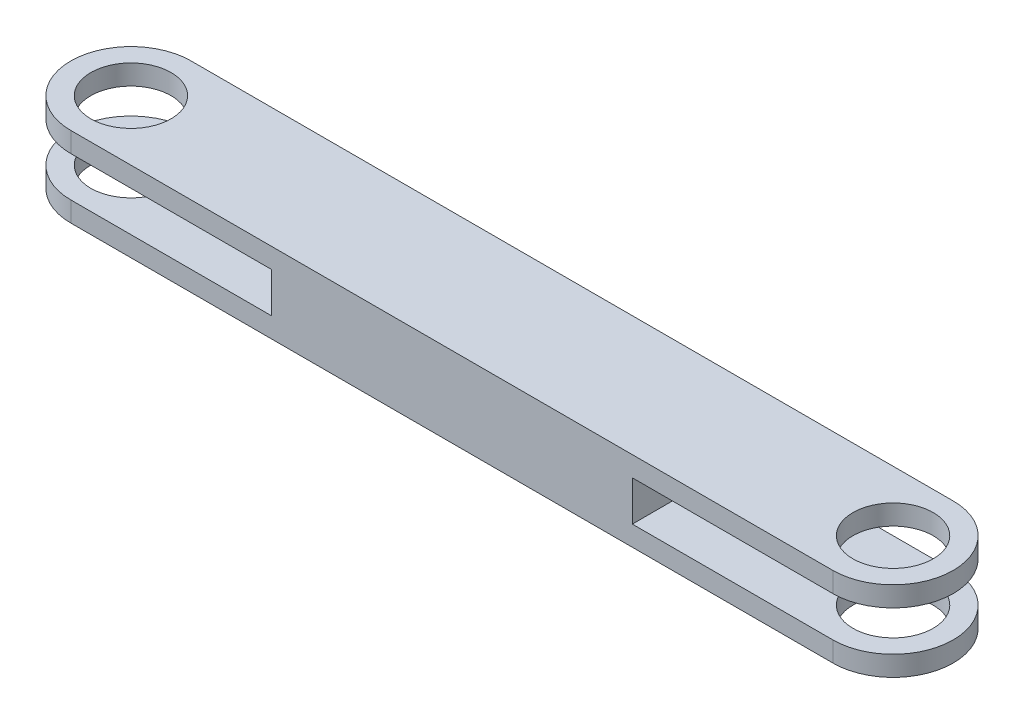
from build123d import *
from build123d.topology import SkipClean

# Parameters (mm, degrees)
EXTRUDE_1_DEPTH     = 10
CUT_EXTRUDE_1_DEPTH = 5


with BuildPart() as part:
    # 草圖1 → 填料-伸長1 (new, symmetric)
    with BuildSketch(Plane(origin=(0, 0, 0), x_dir=(1, 0, 0), z_dir=(0, 1, 0))):
        with BuildLine():
            Line((95.00000000000004, 14.999999999999998), (-94.99999999999996, 15))
            ThreePointArc((-94.99999999999996, 14.999999999999998), (-84.39339828220174, 10.606601717798211), (-79.99999999999996, 0))
            ThreePointArc((-79.99999999999996, -3.67e-15), (-84.39339828220174, -10.606601717798204), (-94.99999999999994, -14.999999999999998))
            Line((-94.99999999999994, -14.999999999999961), (95.00000000000006, -14.999999999999998))
            ThreePointArc((95.00000000000004, -14.999999999999998), (80.00000000000004, 1.84e-15), (95.00000000000004, 14.999999999999998))
        make_face()
        with BuildLine():
            ThreePointArc((-79.99999999999996, 0), (-84.39339828220174, 10.606601717798211), (-94.99999999999996, 14.999999999999998))
            Line((-94.99999999999996, 15), (-94.99999999999996, 10.000000000000009))
            ThreePointArc((-95, 10.000000000000009), (-87.9289321881345, 7.071067811865497), (-84.99999999999994, 0))
            ThreePointArc((-84.99999999999994, -2.45e-15), (-87.9289321881345, -7.071067811865502), (-95, -10.000000000000009))
            Line((-94.99999999999994, -10.000000000000007), (-94.99999999999994, -14.999999999999961))
            ThreePointArc((-94.99999999999994, -14.999999999999998), (-84.39339828220174, -10.606601717798204), (-79.99999999999996, -3.67e-15))
        make_face()
        with BuildLine():
            Line((-94.99999999999996, 10.000000000000009), (-94.99999999999996, 15))
            ThreePointArc((-94.99999999999996, 14.999999999999998), (-109.99999999999996, -4.82e-15), (-94.99999999999994, -14.999999999999998))
            Line((-94.99999999999994, -14.999999999999961), (-94.99999999999994, -10.000000000000007))
            ThreePointArc((-95, -10.000000000000009), (-104.99999999999997, 1.22e-15), (-95, 10.000000000000009))
        make_face()
        with BuildLine():
            ThreePointArc((-79.99999999999996, 0), (-84.39339828220174, 10.606601717798211), (-94.99999999999996, 14.999999999999998))
            Line((-94.99999999999996, 15), (-94.99999999999996, 10.000000000000009))
            ThreePointArc((-95, 10.000000000000009), (-87.9289321881345, 7.071067811865497), (-84.99999999999994, 0))
            ThreePointArc((-84.99999999999994, -2.45e-15), (-87.9289321881345, -7.071067811865502), (-95, -10.000000000000009))
            Line((-94.99999999999994, -10.000000000000007), (-94.99999999999994, -14.999999999999961))
            ThreePointArc((-94.99999999999994, -14.999999999999998), (-84.39339828220174, -10.606601717798204), (-79.99999999999996, -3.67e-15))
        make_face()
        with BuildLine():
            Line((-94.99999999999996, 10.000000000000009), (-94.99999999999996, 15))
            ThreePointArc((-94.99999999999996, 14.999999999999998), (-109.99999999999996, -4.82e-15), (-94.99999999999994, -14.999999999999998))
            Line((-94.99999999999994, -14.999999999999961), (-94.99999999999994, -10.000000000000007))
            ThreePointArc((-95, -10.000000000000009), (-104.99999999999997, 1.22e-15), (-95, 10.000000000000009))
        make_face()
        with BuildLine():
            ThreePointArc((110.00000000000004, 0), (105.60660171779826, 10.606601717798211), (95.00000000000004, 14.999999999999998))
            Line((95.00000000000004, 14.999999999999998), (95.00000000000004, 10.000000000000009))
            ThreePointArc((95, 10.000000000000009), (102.0710678118655, 7.071067811865497), (105.00000000000006, 0))
            ThreePointArc((105.00000000000006, -2.45e-15), (102.0710678118655, -7.071067811865502), (95, -10.000000000000009))
            Line((95.00000000000004, -10.000000000000009), (95.00000000000004, -14.999999999999998))
            ThreePointArc((95.00000000000004, -14.999999999999998), (105.60660171779826, -10.606601717798213), (110.00000000000004, -3.67e-15))
        make_face()
        with BuildLine():
            Line((95.00000000000004, 10.000000000000009), (95.00000000000004, 14.999999999999998))
            ThreePointArc((95.00000000000004, 14.999999999999998), (80.00000000000004, 1.84e-15), (95.00000000000004, -14.999999999999998))
            Line((95.00000000000004, -14.999999999999998), (95.00000000000004, -10.000000000000009))
            ThreePointArc((95, -10.000000000000009), (85.00000000000003, 1.22e-15), (95, 10.000000000000009))
        make_face()
        with BuildLine():
            ThreePointArc((110.00000000000004, 0), (105.60660171779826, 10.606601717798211), (95.00000000000004, 14.999999999999998))
            Line((95.00000000000004, 14.999999999999998), (95.00000000000004, 10.000000000000009))
            ThreePointArc((95, 10.000000000000009), (102.0710678118655, 7.071067811865497), (105.00000000000006, 0))
            ThreePointArc((105.00000000000006, -2.45e-15), (102.0710678118655, -7.071067811865502), (95, -10.000000000000009))
            Line((95.00000000000004, -10.000000000000009), (95.00000000000004, -14.999999999999998))
            ThreePointArc((95.00000000000004, -14.999999999999998), (105.60660171779826, -10.606601717798213), (110.00000000000004, -3.67e-15))
        make_face()
        with BuildLine():
            Line((95.00000000000004, 10.000000000000009), (95.00000000000004, 14.999999999999998))
            ThreePointArc((95.00000000000004, 14.999999999999998), (80.00000000000004, 1.84e-15), (95.00000000000004, -14.999999999999998))
            Line((95.00000000000004, -14.999999999999998), (95.00000000000004, -10.000000000000009))
            ThreePointArc((95, -10.000000000000009), (85.00000000000003, 1.22e-15), (95, 10.000000000000009))
        make_face()
    extrude(amount=EXTRUDE_1_DEPTH, both=True)

    # 草圖2 → 除料-伸長1 (cut, symmetric)
    with SkipClean():  # the faces are left unmerged after this step: merging them gives an invalid solid
        with BuildSketch(Plane(origin=(0, 0, 0), x_dir=(1, 0, 0), z_dir=(0, 1, 0))):
            with BuildLine():
                Line((-44.99999999999994, 14.99999999999999), (-44.99999999999996, -14.999999999999977))
                Line((-44.99999999999996, -14.999999999999977), (-94.99999999999994, -14.99999999999998))
                ThreePointArc((-94.99999999999994, -14.99999999999998), (-109.99999999999994, -4.82e-15), (-94.99999999999996, 14.99999999999998))
                Line((-94.99999999999996, 14.99999999999998), (-44.99999999999994, 14.99999999999999))
            make_face()
        cut_extrude_1 = extrude(amount=CUT_EXTRUDE_1_DEPTH, both=True, mode=Mode.SUBTRACT)

    # 鏡射1: 除料-伸長1 across plane
    with SkipClean():  # the faces are left unmerged after this step: merging them gives an invalid solid
        add(cut_extrude_1.mirror(Plane(origin=(0, 0, 0), x_dir=(0, 0, 1), z_dir=(1, 0, 0))), mode=Mode.SUBTRACT)


solid = part.part
